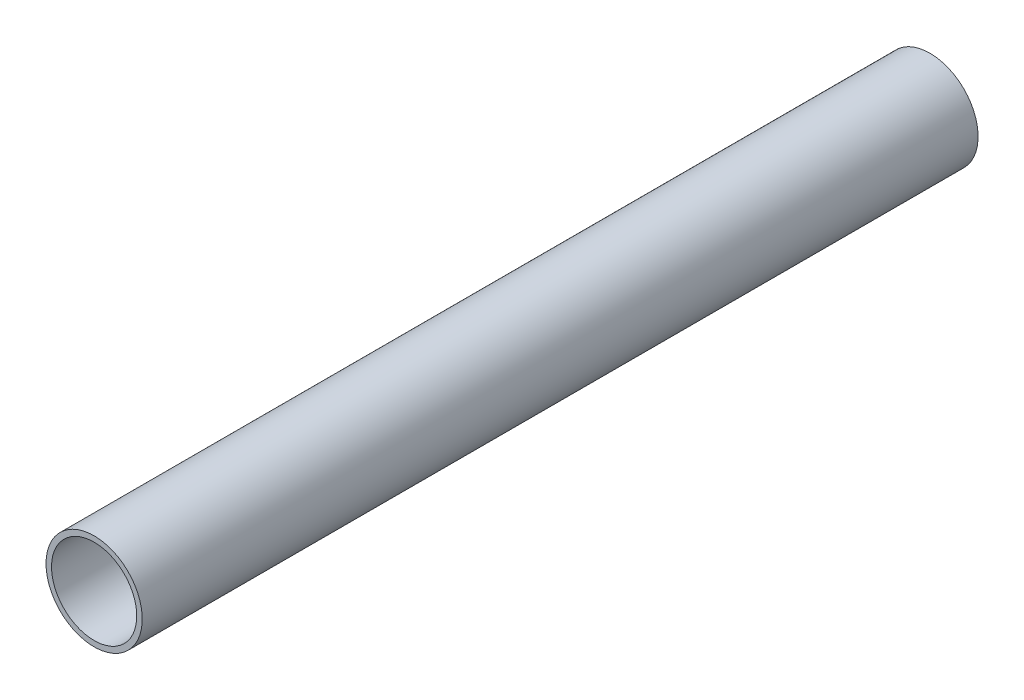
from build123d import *

# Parameters (mm, degrees)
CROQUIS1_R              = 26.2
CROQUIS1_R_2            = 23.2
SALIENTE_EXTRUIR1_DEPTH = 455


with BuildPart() as part:
    # Croquis1 → Saliente-Extruir1 (new body)
    with BuildSketch(Plane.XY):
        with Locations(Location((0, 0, 0), (0, 0, 180))):
            Circle(CROQUIS1_R)
        with Locations(Location((0, 0, 0), (0, 0, 180))):
            Circle(CROQUIS1_R_2, mode=Mode.SUBTRACT)
    extrude(amount=SALIENTE_EXTRUIR1_DEPTH)


solid = part.part
